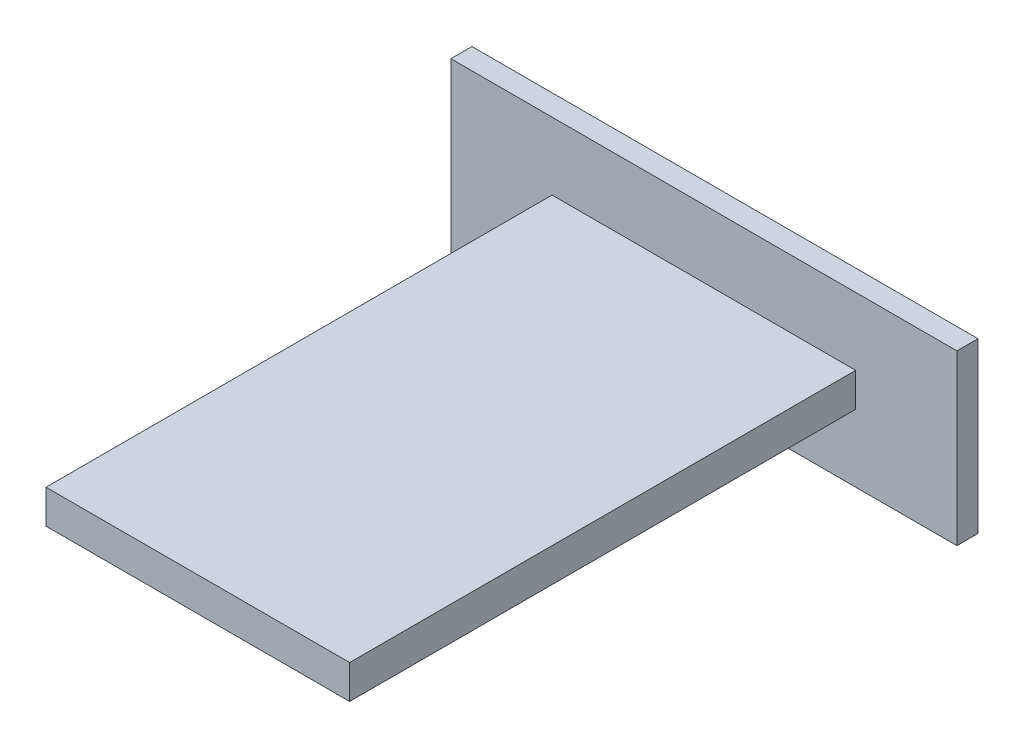
from build123d import *

# Parameters (mm, degrees)
SKETCH1_W           = 18
SKETCH1_H           = 30
BOSS_EXTRUDE1_DEPTH = 2
SKETCH2_W           = 30
SKETCH2_H           = 10
BOSS_EXTRUDE2_DEPTH = 1.25


with BuildPart() as part:
    # Sketch1 → Boss-Extrude1 (new body)
    with BuildSketch(Plane(origin=(0, 0, 0), x_dir=(1, 0, 0), z_dir=(0, 1, 0))):
        Rectangle(SKETCH1_W, SKETCH1_H)
    extrude(amount=BOSS_EXTRUDE1_DEPTH)

    # Sketch2 → Boss-Extrude2 (add)
    with BuildSketch(Plane(origin=(0, 0, -15), x_dir=(-1, 0, 0), z_dir=(0, 0, -1))):
        with Locations((0, 1)):
            Rectangle(SKETCH2_W, SKETCH2_H)
    extrude(amount=BOSS_EXTRUDE2_DEPTH)


solid = part.part
